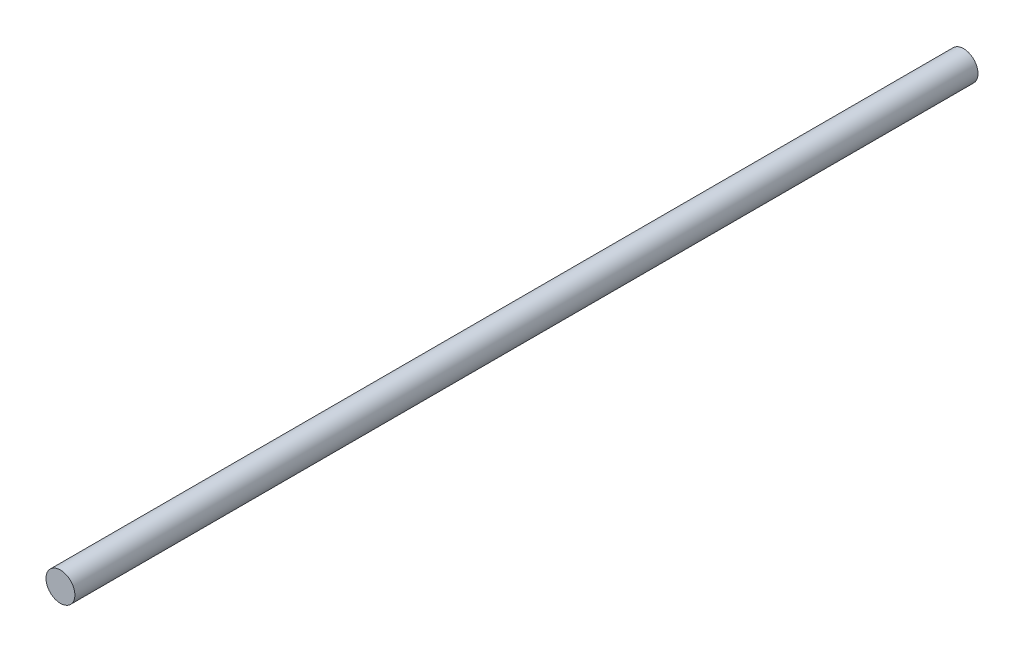
from build123d import *

# Parameters (mm, degrees)
CROQUIS1_R              = 4
SALIENTE_EXTRUIR1_DEPTH = 250


with BuildPart() as part:
    # Croquis1 → Saliente-Extruir1 (new body)
    with BuildSketch(Plane.XY):
        Circle(CROQUIS1_R)
    extrude(amount=SALIENTE_EXTRUIR1_DEPTH)


solid = part.part
